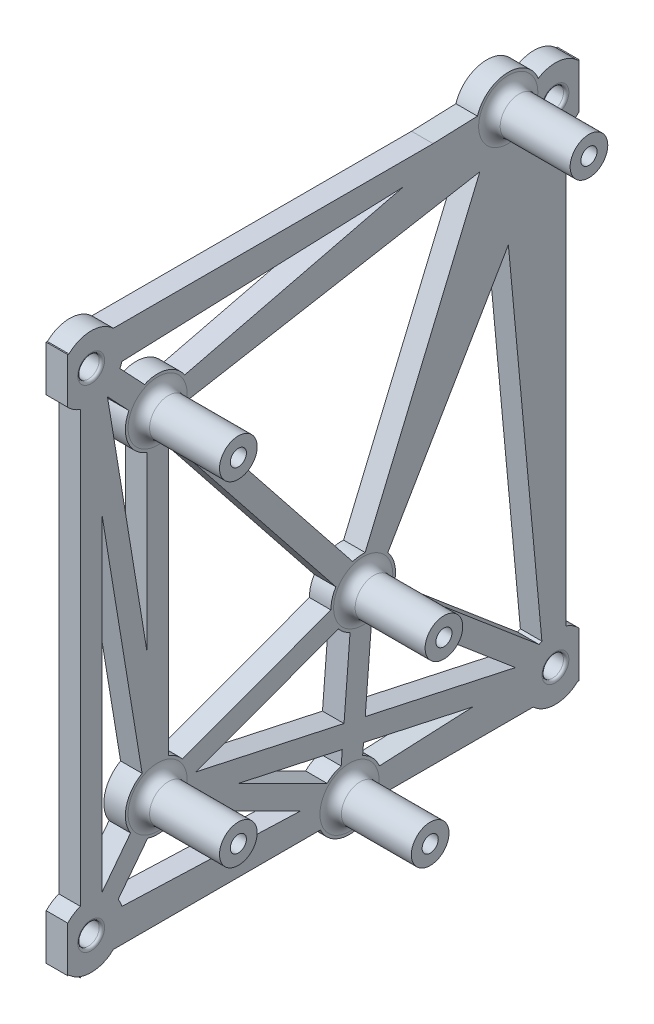
from build123d import *

# Parameters (mm, degrees)
SKETCH1_W           = 95
SKETCH1_H           = 110
SKETCH1_R           = 2
BOSS_EXTRUDE1_DEPTH = 4
SKETCH2_R           = 3.5
SKETCH2_R_2         = 1.5
BOSS_EXTRUDE2_DEPTH = 15
CUT_EXTRUDE1_DEPTH  = 75.204110398
FILLET1_R           = 2
FILLET2_R           = 0.5


with BuildPart() as part:
    # Sketch1 → Boss-Extrude1 (new body)
    with BuildSketch(Plane(origin=(0, 0, 0), x_dir=(0, 0, -1), z_dir=(1, 0, 0))):
        Rectangle(SKETCH1_W, SKETCH1_H)
        with Locations((-43.15, 45.65)):
            Circle(SKETCH1_R, mode=Mode.SUBTRACT)
        with Locations((43.15, 45.65)):
            Circle(SKETCH1_R, mode=Mode.SUBTRACT)
        with Locations((43.15, -45.65)):
            Circle(SKETCH1_R, mode=Mode.SUBTRACT)
        with Locations((-43.15, -45.65)):
            Circle(SKETCH1_R, mode=Mode.SUBTRACT)
    extrude(amount=BOSS_EXTRUDE1_DEPTH)

    # Sketch2 → Boss-Extrude2 (add)
    # profile 1 of 5: a face of its own
    with BuildSketch(Plane(origin=(4, 0, 0), x_dir=(0, 0, -1), z_dir=(1, 0, 0))):
        with Locations((4.871830735, -47.445058297)):
            Circle(SKETCH2_R)
        with Locations((4.871830735, -47.445058297)):
            Circle(SKETCH2_R_2, mode=Mode.SUBTRACT)
    # profile 2 of 5: a face of its own
    with BuildSketch(Plane(origin=(4, 0, 0), x_dir=(0, 0, -1), z_dir=(1, 0, 0))):
        with Locations((-30.788169265, -29.585058297)):
            Circle(SKETCH2_R)
        with Locations((-30.788169265, -29.585058297)):
            Circle(SKETCH2_R_2, mode=Mode.SUBTRACT)
    # profile 3 of 5: a face of its own
    with BuildSketch(Plane(origin=(4, 0, 0), x_dir=(0, 0, -1), z_dir=(1, 0, 0))):
        with Locations((7.421830735, -15.485058297)):
            Circle(SKETCH2_R)
        with Locations((7.421830735, -15.485058297)):
            Circle(SKETCH2_R_2, mode=Mode.SUBTRACT)
    # profile 4 of 5: a face of its own
    with BuildSketch(Plane(origin=(4, 0, 0), x_dir=(0, 0, -1), z_dir=(1, 0, 0))):
        with Locations((-30.788169265, 32.564941703)):
            Circle(SKETCH2_R)
        with Locations((-30.788169265, 32.564941703)):
            Circle(SKETCH2_R_2, mode=Mode.SUBTRACT)
    # profile 5 of 5: a face of its own
    with BuildSketch(Plane(origin=(4, 0, 0), x_dir=(0, 0, -1), z_dir=(1, 0, 0))):
        with Locations((34.381830735, 48.514941703)):
            Circle(SKETCH2_R)
        with Locations((34.381830735, 48.514941703)):
            Circle(SKETCH2_R_2, mode=Mode.SUBTRACT)
    extrude(amount=BOSS_EXTRUDE2_DEPTH)

    # Sketch3 → Cut-Extrude1 (cut, through all)
    with BuildSketch(Plane(origin=(4, 0, 0), x_dir=(0, 0, -1), z_dir=(1, 0, 0))):
        with BuildLine():
            Line((-47.282493194, -50), (-47.5, -50))
            Line((-47.5, -50), (-47.5, -55))
            Line((-47.5, -55), (47.5, -55))
            Line((47.5, -55), (47.5, -50))
            Line((47.5, -50), (47.282493194, -50))
            ThreePointArc((47.282493194, -50), (43.15, -51.65), (39.017506806, -50))
            Line((39.017506806, -50), (10.300667894, -50))
            ThreePointArc((10.300667894, -50), (4.871830735, -53.445058297), (-0.557006424, -50))
            Line((-0.557006424, -50), (-39.017506806, -50))
            ThreePointArc((-39.017506806, -50), (-41.829676039, -51.50292616), (-45.014729802, -51.352874956))
            Line((-45.014729802, -51.352874956), (-45.15, -51.528666704))
            Line((-45.15, -51.528666704), (-45.15, -51.306854249))
            ThreePointArc((-45.15, -51.306854249), (-46.285097319, -50.76577607), (-47.282493194, -50))
        make_face()
        with BuildLine():
            Line((-47.5, 50), (-47.282493194, 50))
            ThreePointArc((-47.282493194, 50), (-43.15, 51.65), (-39.017506806, 50))
            Line((-39.017506806, 50), (20.409399266, 50))
            Line((20.409399266, 50), (28.65498135, 50.304689206))
            ThreePointArc((28.65498135, 50.304689206), (34.156024722, 54.510691167), (39.957841268, 50.730366387))
            ThreePointArc((39.957841268, 50.730366387), (43.745328472, 51.620392283), (47.282493194, 50))
            Line((47.282493194, 50), (47.5, 50))
            Line((47.5, 50), (47.5, 55))
            Line((47.5, 55), (-47.5, 55))
            Line((-47.5, 55), (-47.5, 50))
        make_face()
        with BuildLine():
            Line((-25.768943429, 35.852398471), (14.841232242, 45.791516193))
            Line((14.841232242, 45.791516193), (-37.423150615, 43.860252496))
            ThreePointArc((-37.423150615, 43.860252496), (-37.59698993, 43.377538963), (-37.811432926, 42.911441694))
            Line((-37.811432926, 42.911441694), (-33.219096413, 38.050431034))
            ThreePointArc((-33.219096413, 38.050431034), (-29.090329664, 38.319708482), (-25.768943429, 35.852398471))
        make_face()
        with BuildLine():
            ThreePointArc((-24.869341644, 31.5813363), (-25.176837259, 30.440570475), (-25.701912307, 29.382177157))
            Line((-25.701912307, 29.382177157), (5.466345895, -9.812662063))
            ThreePointArc((5.466345895, -9.812662063), (6.604999175, -9.540919487), (7.774745949, -9.495446386))
            Line((7.774745949, -9.495446386), (29.101888797, 41.132785893))
            Line((29.101888797, 41.132785893), (-24.869341644, 31.5813363))
        make_face()
        with BuildLine():
            ThreePointArc((40.117889412, -40.472519398), (40.372744436, -40.331461523), (40.634145174, -40.202938912))
            Line((40.634145174, -40.202938912), (34.402742909, 26.718628547))
            Line((34.402742909, 26.718628547), (12.002837097, -11.610218854))
            ThreePointArc((12.002837097, -11.610218854), (13.05592508, -13.421813059), (13.421830735, -15.485058297))
            ThreePointArc((13.421830735, -15.485058297), (13.324175672, -16.563169724), (13.034389319, -17.606186803))
            Line((13.034389319, -17.606186803), (40.117889412, -40.472519398))
        make_face()
        with BuildLine():
            Line((-33.678882573, -24.327323369), (-41.15, 21.142475339))
            Line((-41.15, 21.142475339), (-41.15, -39.771333296))
            Line((-41.15, -39.771333296), (-35.822996048, -32.848571629))
            ThreePointArc((-35.822996048, -32.848571629), (-36.606800067, -28.120976472), (-33.678882573, -24.327323369))
        make_face()
        with BuildLine():
            Line((-32.652899068, -35.287933253), (-38.115173217, -42.386486668))
            ThreePointArc((-38.115173217, -42.386486668), (-37.718394632, -43.100948584), (-37.422385765, -43.86270171))
            Line((-37.422385765, -43.86270171), (-4.272877469, -45.101831893))
            Line((-4.272877469, -45.101831893), (-26.625858733, -33.906536173))
            ThreePointArc((-26.625858733, -33.906536173), (-29.44772763, -35.433409879), (-32.652899068, -35.287933253))
        make_face()
        with BuildLine():
            Line((2.807170019, -19.319756001), (-23.6611506, -29.08691959))
            Line((-23.6611506, -29.08691959), (3.853236056, -35.065117617))
            Line((3.853236056, -35.065117617), (4.978251557, -20.964923333))
            ThreePointArc((4.978251557, -20.964923333), (3.798112826, -20.267177965), (2.807170019, -19.319756001))
        make_face()
        with BuildLine():
            Line((8.96558002, -21.283061242), (7.797569686, -35.922124092))
            Line((7.797569686, -35.922124092), (35.711318156, -41.987093598))
            Line((35.711318156, -41.987093598), (10.453941322, -20.662538899))
            ThreePointArc((10.453941322, -20.662538899), (9.730701755, -21.023028558), (8.96558002, -21.283061242))
        make_face()
        with BuildLine():
            Line((-28.788169265, 26.836566577), (-28.788169265, -23.928204048))
            ThreePointArc((-28.788169265, -23.928204048), (-27.357644857, -24.662507913), (-26.17350855, -25.750360593))
            Line((-26.17350855, -25.750360593), (1.422391734, -15.567105058))
            ThreePointArc((1.422391734, -15.567105058), (1.64360333, -13.868862747), (2.335573777, -12.302293752))
            Line((2.335573777, -12.302293752), (-28.788169265, 26.836566577))
        make_face()
        with BuildLine():
            Line((-40.117182266, 39.52740654), (-32.788169265, -5.077533636))
            Line((-32.788169265, -5.077533636), (-32.788169265, 26.908087453))
            ThreePointArc((-32.788169265, 26.908087453), (-36.363505997, 30.347821875), (-36.126736339, 35.303500008))
            Line((-36.126736339, 35.303500008), (-40.117182266, 39.52740654))
        make_face()
        with BuildLine():
            Line((10.428787864, -45.182266336), (27.823296257, -44.366549251))
            Line((27.823296257, -44.366549251), (7.476539649, -39.945700561))
            Line((7.476539649, -39.945700561), (7.315409912, -41.965193262))
            ThreePointArc((7.315409912, -41.965193262), (9.183389048, -43.272473378), (10.428787864, -45.182266336))
        make_face()
        with BuildLine():
            Line((-15.682387069, -34.913836622), (0.709520202, -43.123580421))
            ThreePointArc((0.709520202, -43.123580421), (1.924830356, -42.218664821), (3.328081449, -41.647055353))
            Line((3.328081449, -41.647055353), (3.532206019, -39.088694086))
            Line((3.532206019, -39.088694086), (-15.682387069, -34.913836622))
        make_face()
        with BuildLine():
            Line((-47.5, 41.517506806), (-47.5, -41.517506806))
            ThreePointArc((-47.5, -41.517506806), (-46.415202009, -40.616268199), (-45.15, -39.993145751))
            Line((-45.15, -39.993145751), (-45.15, 39.993145751))
            ThreePointArc((-45.15, 39.993145751), (-46.415202009, 40.616268199), (-47.5, 41.517506806))
        make_face()
        with BuildLine():
            ThreePointArc((45.15, -39.993145751), (46.415202009, -40.616268199), (47.5, -41.517506806))
            Line((47.5, -41.517506806), (47.5, 41.517506806))
            ThreePointArc((47.5, 41.517506806), (46.415202009, 40.616268199), (45.15, 39.993145751))
            Line((45.15, 39.993145751), (45.15, -39.993145751))
        make_face()
    extrude(amount=-CUT_EXTRUDE1_DEPTH, mode=Mode.SUBTRACT)

    # Fillet1
    fillet1_edges = [part.edges().sort_by_distance(p)[0] for p in [
        (4, -47.445058297, -1.371830735),
        (4, -29.585058297, 34.288169265),
        (4, -15.485058297, -3.921830735),
        (4, 32.564941703, 34.288169265),
        (4, 48.514941703, -30.881830735),
    ]]
    fillet(fillet1_edges, radius=FILLET1_R)

    # Fillet2
    fillet2_edges = [part.edges().sort_by_distance(p)[0] for p in [
        (4, 45.65, 45.15),
        (4, 45.65, -41.15),
        (4, -45.65, 45.15),
        (4, -45.65, -41.15),
    ]]
    fillet(fillet2_edges, radius=FILLET2_R)


solid = part.part
